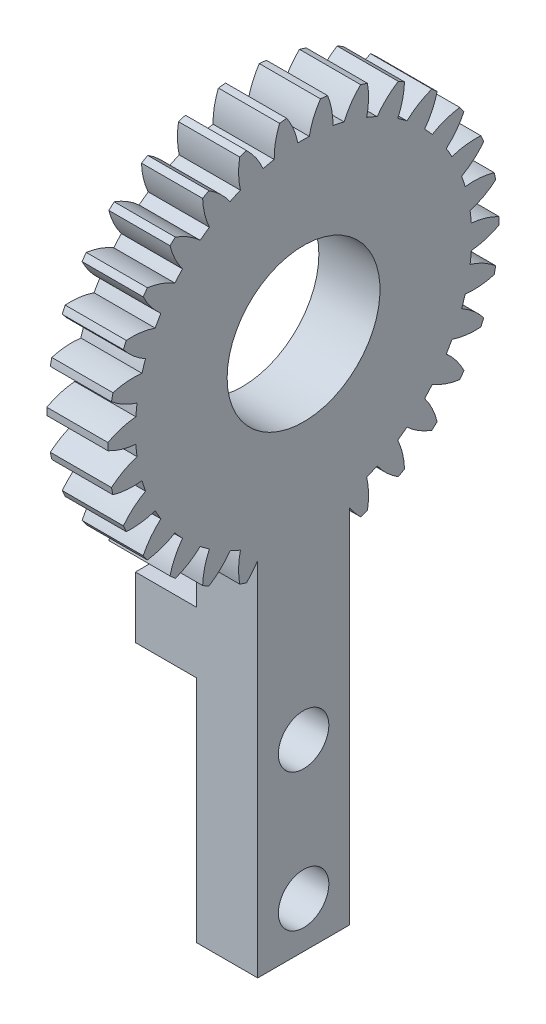
from build123d import *

# Parameters (mm, degrees)
BASPROSKE_W         = 4
BASPROSKE_H         = 12.8
TOOTHCUT_DEPTH      = 19.538608362
TEETHCUTS_COUNT     = 30
TEETHCUTS_ANGLE     = 348
BORSKE_R            = 5
BORE_DEPTH          = 50.0000508
SKETCH_1_W          = 6
SKETCH_1_H          = 28.363297546
EXTRUDE_1_DEPTH     = 4
SKETCH_4_W          = 2
SKETCH_4_H          = 15
CUT_EXTRUDE_2_DEPTH = 6
SKETCH_6_R          = 1.65
CUT_EXTRUDE_3_DEPTH = 4
EXTRUDE_START       = 2
SKETCH_8_W          = 6
SKETCH_8_H          = 15
SKETCH_8_R          = 1.65
EXTRUDE_2_DEPTH     = 2
SKETCH_9_W          = 4
SKETCH_9_H          = 4
EXTRUDE_3_DEPTH     = 6


with BuildPart() as part:
    # BasProSke → Base-Revolve (revolve)
    with BuildSketch(Plane(origin=(0, 0, 0), x_dir=(1, 0, 0), z_dir=(0, 1, 0)), mode=Mode.PRIVATE) as base_revolve_sk:
        with Locations((2, 6.4)):
            Rectangle(BASPROSKE_W, BASPROSKE_H)
    revolve(base_revolve_sk.sketch.rotate(Axis((-10, 0, 0), (1, 0, 0)), 180), axis=Axis((-10, 0, 0), (1, 0, 0)))

    # TooCutSke → ToothCut (cut, through all)
    with BuildSketch(Plane(origin=(0, 0, 0), x_dir=(0, 0, -1), z_dir=(1, 0, 0))):
        with BuildLine():
            ThreePointArc((0.37243947, 10.992692566), (0, 10.999), (-0.37243947, 10.992692566))
            ThreePointArc((-0.37243947, 10.992692566), (-0.655704499, 11.922595954), (-1.120515575, 12.776358245))
            ThreePointArc((-1.120515575, 12.776358245), (0, 12.8254), (1.120515575, 12.776358245))
            ThreePointArc((1.120515575, 12.776358245), (0.655704499, 11.922595954), (0.37243947, 10.992692566))
        make_face()
    toothcut = extrude(amount=TOOTHCUT_DEPTH, mode=Mode.SUBTRACT)

    # TeethCuts: ToothCut ×30 about axis
    teethcuts_axis = Axis((-10, 0, 0), (1, 0, 0))
    for i in range(1, TEETHCUTS_COUNT):
        add(toothcut.rotate(teethcuts_axis, i * TEETHCUTS_ANGLE / (TEETHCUTS_COUNT - 1)), mode=Mode.SUBTRACT)

    # BorSke → Bore (cut, symmetric)
    with BuildSketch(Plane(origin=(0, 0, 0), x_dir=(0, 0, -1), z_dir=(1, 0, 0))):
        with Locations(Location((0, 0, 0), (0, 0, 180))):
            Circle(BORSKE_R)
    extrude(amount=BORE_DEPTH, both=True, mode=Mode.SUBTRACT)

    # 草图1 → 凸台-拉伸1 (add)
    with BuildSketch(Plane(origin=(4, 0, 0), x_dir=(0, 0, -1), z_dir=(1, 0, 0))):
        with Locations((0, -20.818351227)):
            Rectangle(SKETCH_1_W, SKETCH_1_H)
    extrude(amount=-EXTRUDE_1_DEPTH)

    # 草图4 → 切除-拉伸2 (cut)
    with BuildSketch(Plane(origin=(0, 0, -3), x_dir=(-1, 0, 0), z_dir=(0, 0, -1))):
        with Locations((-1, -27.5)):
            Rectangle(SKETCH_4_W, SKETCH_4_H)
    extrude(amount=-CUT_EXTRUDE_2_DEPTH, mode=Mode.SUBTRACT)

    # 草图6 → 切除-拉伸3 (cut)
    with BuildSketch(Plane.ZY.offset(-2)):
        with Locations((0, -23)):
            Circle(SKETCH_6_R)
        with Locations((0, -32)):
            Circle(SKETCH_6_R)
    extrude(amount=-CUT_EXTRUDE_3_DEPTH, mode=Mode.SUBTRACT)

    # 草图8 → 凸台-拉伸2 (add)
    with BuildSketch(Plane.ZY.offset(-2).offset(EXTRUDE_START)):
        with Locations((0, -27.5)):
            Rectangle(SKETCH_8_W, SKETCH_8_H)
        with Locations((0, -23)):
            Circle(SKETCH_8_R, mode=Mode.SUBTRACT)
        with Locations((0, -32)):
            Circle(SKETCH_8_R, mode=Mode.SUBTRACT)
    extrude(amount=-EXTRUDE_2_DEPTH)

    # 草图9 → 凸台-拉伸3 (add)
    with BuildSketch(Plane.XY.offset(3)):
        with Locations((-2, -18)):
            Rectangle(SKETCH_9_W, SKETCH_9_H)
    extrude(amount=-EXTRUDE_3_DEPTH)


solid = part.part
